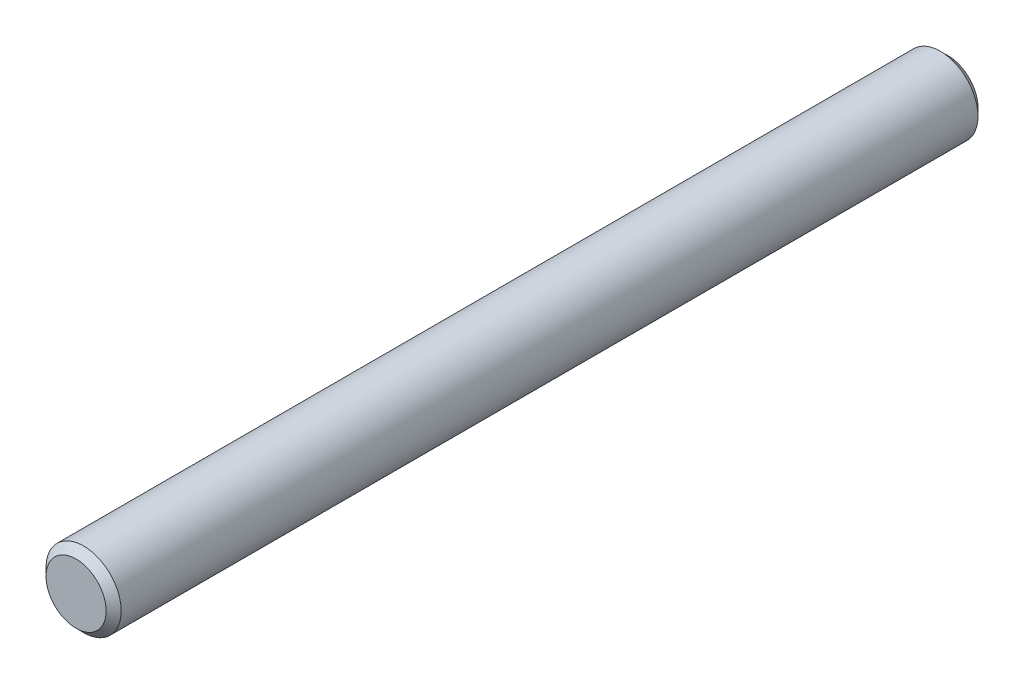
from build123d import *

# Parameters (mm, degrees)
CROQUIS1_R              = 2.5
SALIENTE_EXTRUIR1_DEPTH = 58
CHAFL_N1_SIZE           = 0.5


with BuildPart() as part:
    # Croquis1 → Saliente-Extruir1 (new body)
    with BuildSketch(Plane.XY):
        Circle(CROQUIS1_R)
    extrude(amount=-SALIENTE_EXTRUIR1_DEPTH)

    # Chaflán1
    chafl_n1_edges = [part.edges().sort_by_distance(p)[0] for p in [
        (-2.5, 0, 0),
        (-2.5, 0, -58),
    ]]
    chamfer(chafl_n1_edges, length=CHAFL_N1_SIZE)


solid = part.part
